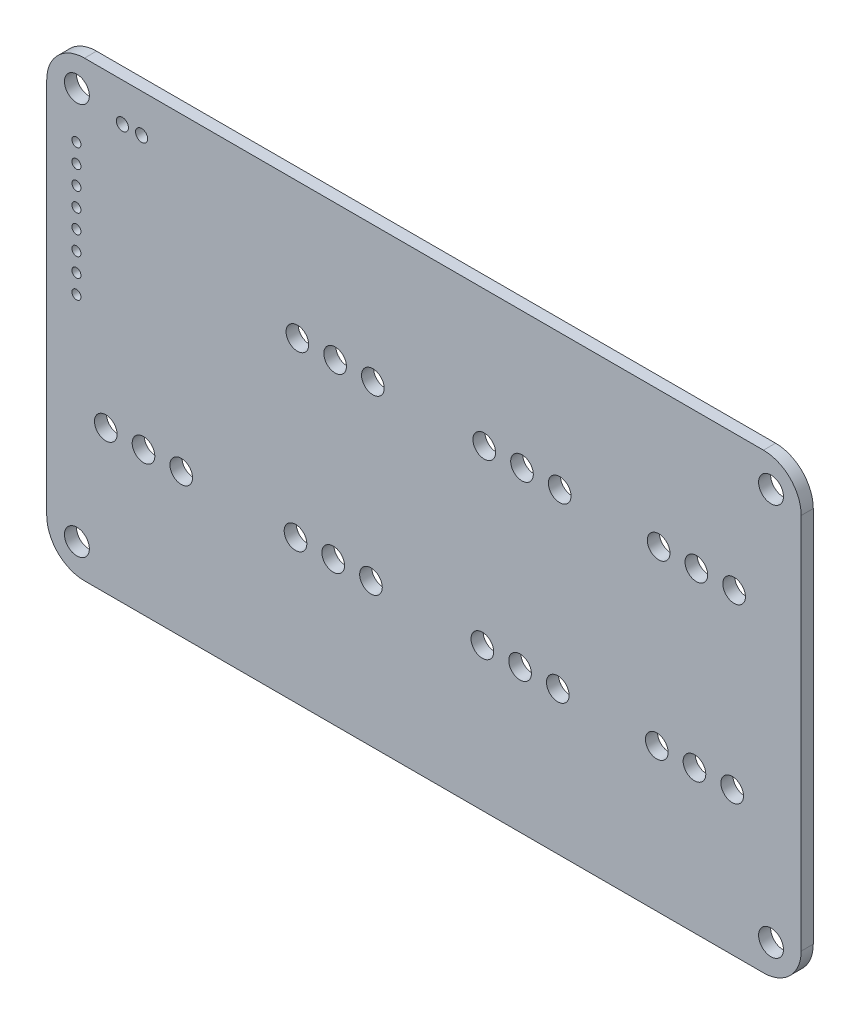
from build123d import *

# Parameters (mm, degrees)
BOSS_EXTRUDE1_DEPTH = 1.6
MULTI_LAYER_R       = 0.6
MULTI_LAYER_R_2     = 1.5
MULTI_LAYER_R_3     = 0.8
MULTI_LAYER_R_4     = 1.6500127
CUT_EXTRUDE2_DEPTH  = 1.6


with BuildPart() as part:
    # BoardOutLine → Boss-Extrude1 (new body)
    with BuildSketch(Plane.XY):
        with BuildLine():
            Line((0, -55), (0, -5))
            ThreePointArc((0, -5), (1.464466094, -1.464466094), (5, 0))
            Line((5, 0), (95, 0))
            ThreePointArc((95, 0), (98.535533906, -1.464466094), (100, -5))
            Line((100, -5), (100, -55))
            ThreePointArc((100, -55), (98.535533906, -58.535533906), (95, -60))
            Line((95, -60), (5, -60))
            ThreePointArc((5, -60), (1.464466094, -58.535533906), (0, -55))
        make_face()
    extrude(amount=BOSS_EXTRUDE1_DEPTH)

    # Multi-Layer → Cut-Extrude2 (cut)
    with BuildSketch(Plane.XY.offset(1.6)):
        with Locations((3.937007874, -25.172974346)):
            Circle(MULTI_LAYER_R)
        with Locations((3.937007874, -22.673101346)):
            Circle(MULTI_LAYER_R)
        with Locations((3.937007874, -20.172974346)):
            Circle(MULTI_LAYER_R)
        with Locations((3.937007874, -17.673101346)):
            Circle(MULTI_LAYER_R)
        with Locations((3.937007874, -15.172974346)):
            Circle(MULTI_LAYER_R)
        with Locations((3.937007874, -12.673101346)):
            Circle(MULTI_LAYER_R)
        with Locations((3.937007874, -10.172974346)):
            Circle(MULTI_LAYER_R)
        with Locations((32.974345949, -41.021082042)):
            Circle(MULTI_LAYER_R_2)
        with Locations((37.973075946, -41.021082042)):
            Circle(MULTI_LAYER_R_2)
        with Locations((42.974345949, -41.021082042)):
            Circle(MULTI_LAYER_R_2)
        with Locations((57.739395479, -41.021082042)):
            Circle(MULTI_LAYER_R_2)
        with Locations((62.738125476, -41.021082042)):
            Circle(MULTI_LAYER_R_2)
        with Locations((67.739395479, -41.021082042)):
            Circle(MULTI_LAYER_R_2)
        with Locations((80.853441707, -41.021082042)):
            Circle(MULTI_LAYER_R_2)
        with Locations((85.852171704, -41.021082042)):
            Circle(MULTI_LAYER_R_2)
        with Locations((90.853441707, -41.021082042)):
            Circle(MULTI_LAYER_R_2)
        with Locations((43.225806452, -18.034036068)):
            Circle(MULTI_LAYER_R_2)
        with Locations((38.227076454, -18.034036068)):
            Circle(MULTI_LAYER_R_2)
        with Locations((33.225806452, -18.034036068)):
            Circle(MULTI_LAYER_R_2)
        with Locations((67.990855982, -18.034036068)):
            Circle(MULTI_LAYER_R_2)
        with Locations((62.992125984, -18.034036068)):
            Circle(MULTI_LAYER_R_2)
        with Locations((57.990855982, -18.034036068)):
            Circle(MULTI_LAYER_R_2)
        with Locations((91.10490221, -18.034036068)):
            Circle(MULTI_LAYER_R_2)
        with Locations((86.106172212, -18.034036068)):
            Circle(MULTI_LAYER_R_2)
        with Locations((81.10490221, -18.034036068)):
            Circle(MULTI_LAYER_R_2)
        with Locations((10.033020066, -5.08001016)):
            Circle(MULTI_LAYER_R_3)
        with Locations((12.573025146, -5.08001016)):
            Circle(MULTI_LAYER_R_3)
        with Locations((7.828295657, -41.021082042)):
            Circle(MULTI_LAYER_R_2)
        with Locations((12.827025654, -41.021082042)):
            Circle(MULTI_LAYER_R_2)
        with Locations((17.828295657, -41.021082042)):
            Circle(MULTI_LAYER_R_2)
        with Locations((3.937007874, -27.673050546)):
            Circle(MULTI_LAYER_R)
        with Locations((4, -4)):
            Circle(MULTI_LAYER_R_4)
        with Locations((96, -56)):
            Circle(MULTI_LAYER_R_4)
        with Locations((96, -4)):
            Circle(MULTI_LAYER_R_4)
        with Locations((4, -56)):
            Circle(MULTI_LAYER_R_4)
    extrude(amount=-CUT_EXTRUDE2_DEPTH, mode=Mode.SUBTRACT)


solid = part.part
